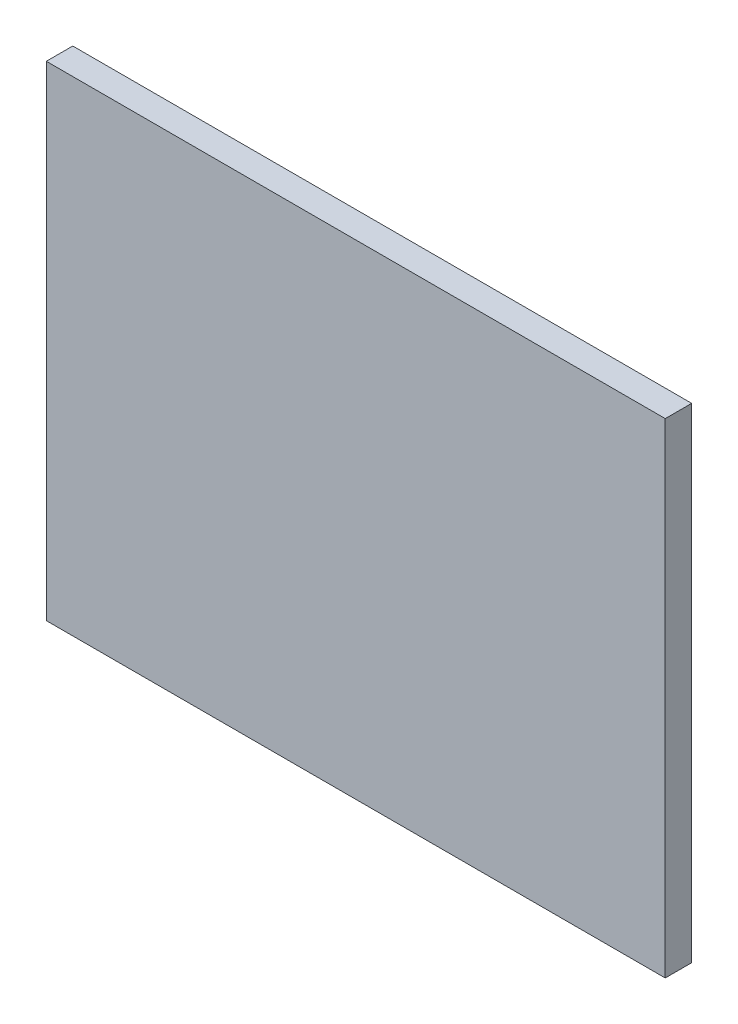
from build123d import *

# Parameters (mm, degrees)
SKETCH1_W           = 107.696
SKETCH1_H           = 84.300000056
BOSS_EXTRUDE1_DEPTH = 4.599999944


with BuildPart() as part:
    # Sketch1 → Boss-Extrude1 (new body)
    with BuildSketch(Plane.XY):
        with Locations((53.848, 42.150000028)):
            Rectangle(SKETCH1_W, SKETCH1_H)
    extrude(amount=BOSS_EXTRUDE1_DEPTH)


solid = part.part
